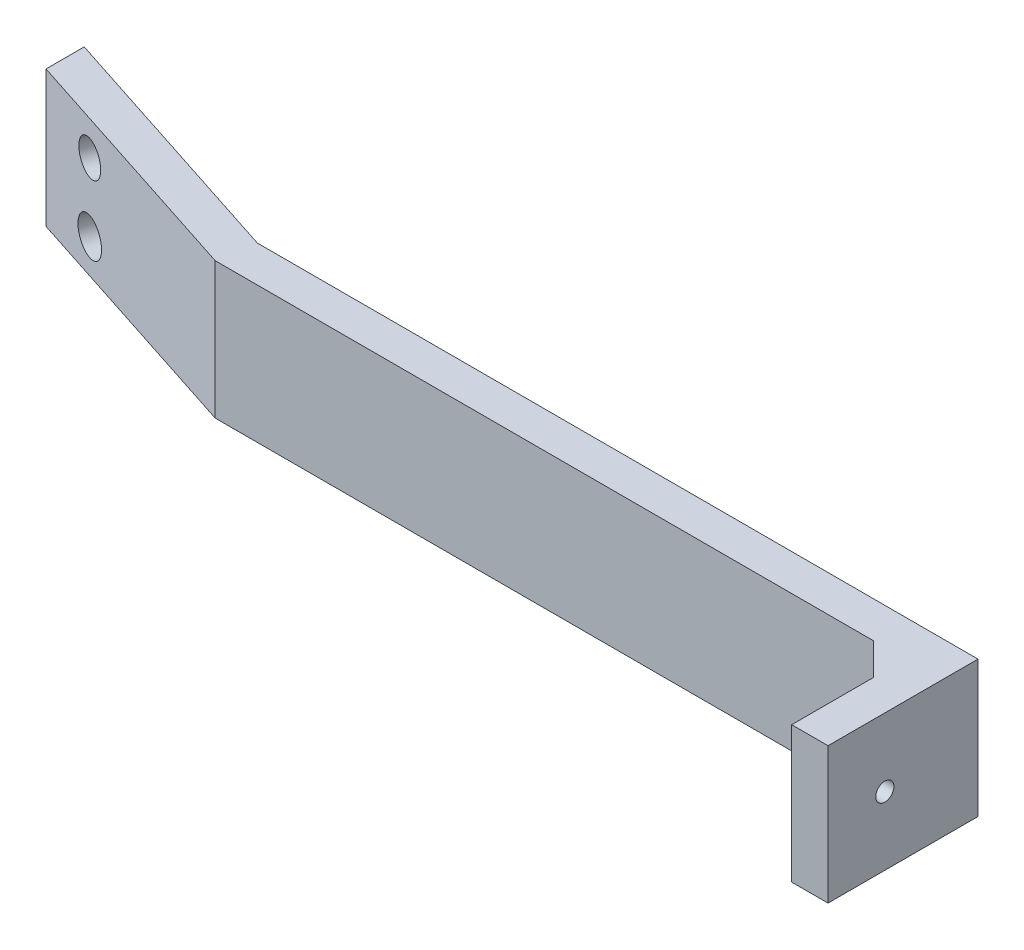
from build123d import *

# Parameters (mm, degrees)
SKETCH5_W           = 215
SKETCH5_H           = 30
BOSS_EXTRUDE3_DEPTH = 50
CUT_EXTRUDE2_DEPTH  = 123.295748086
CUT_EXTRUDE3_DEPTH  = 123.295748086
SKETCH8_W           = 8
SKETCH8_H           = 30
BOSS_EXTRUDE4_DEPTH = 25
SKETCH9_W           = 7
SKETCH9_H           = 5
BOSS_EXTRUDE5_DEPTH = 7
CUT_EXTRUDE4_DEPTH  = 135.466538589
SKETCH11_R          = 2
CUT_EXTRUDE5_DEPTH  = 221.678499179
SKETCH12_R          = 3.740099061
SKETCH12_R_2        = 4.034215751
CUT_EXTRUDE6_DEPTH  = 134.295377202


with BuildPart() as part:
    # Sketch5 → Boss-Extrude3 (new body)
    with BuildSketch(Plane.XY):
        Rectangle(SKETCH5_W, SKETCH5_H)
    extrude(amount=BOSS_EXTRUDE3_DEPTH)

    # Sketch6 → Cut-Extrude2 (cut, through all)
    with BuildSketch(Plane(origin=(0, 15, 0), x_dir=(1, 0, 0), z_dir=(0, 1, 0))):
        Polygon((-107.5, -32.077014326), (-52.338722055, -50), (-107.5, -50), align=None)
    extrude(amount=-CUT_EXTRUDE2_DEPTH, mode=Mode.SUBTRACT)

    # Sketch7 → Cut-Extrude3 (cut, through all)
    with BuildSketch(Plane(origin=(0, 15, 0), x_dir=(1, 0, 0), z_dir=(0, 1, 0))):
        Polygon((107.5, -42), (-51.071646532, -42), (-107.5, -23.665316532), (-107.5, 0), (107.5, 0), align=None)
    extrude(amount=-CUT_EXTRUDE3_DEPTH, mode=Mode.SUBTRACT)

    # Sketch8 → Boss-Extrude4 (add)
    with BuildSketch(Plane.XY.offset(50)):
        with Locations((103.5, 0)):
            Rectangle(SKETCH8_W, SKETCH8_H)
    extrude(amount=BOSS_EXTRUDE4_DEPTH)

    # Sketch9 → Boss-Extrude5 (add)
    with BuildSketch(Plane.ZY.offset(-99.5)):
        with Locations((53.5, -12.5)):
            Rectangle(SKETCH9_W, SKETCH9_H)
        with Locations((53.5, 12.5)):
            Rectangle(SKETCH9_W, SKETCH9_H)
    extrude(amount=BOSS_EXTRUDE5_DEPTH)

    # Sketch10 → Cut-Extrude4 (cut, through all)
    with BuildSketch(Plane.XZ.offset(15)):
        Polygon((92.5, 50), (99.5, 57), (92.5, 57), align=None)
    extrude(amount=-CUT_EXTRUDE4_DEPTH, mode=Mode.SUBTRACT)

    # Sketch11 → Cut-Extrude5 (cut, through all)
    with BuildSketch(Plane.ZY.offset(-99.5)):
        with Locations(Location((62.5, 0, 0), (0, 0, 270))):
            Circle(SKETCH11_R)
    extrude(amount=-CUT_EXTRUDE5_DEPTH, mode=Mode.SUBTRACT)

    # Sketch12 → Cut-Extrude6 (cut, through all)
    with BuildSketch(Plane(origin=(-19.692534532, 0, 60.607389333), x_dir=(0.9510565162951554, 0, 0.3090169943749418), z_dir=(-0.3090169943749418, 0, 0.9510565162951554))):
        with Locations((-77.326232946, 7.5)):
            Circle(SKETCH12_R)
        with Locations((-77.326232946, -7.5)):
            Circle(SKETCH12_R_2)
    extrude(amount=-CUT_EXTRUDE6_DEPTH, mode=Mode.SUBTRACT)


solid = part.part
